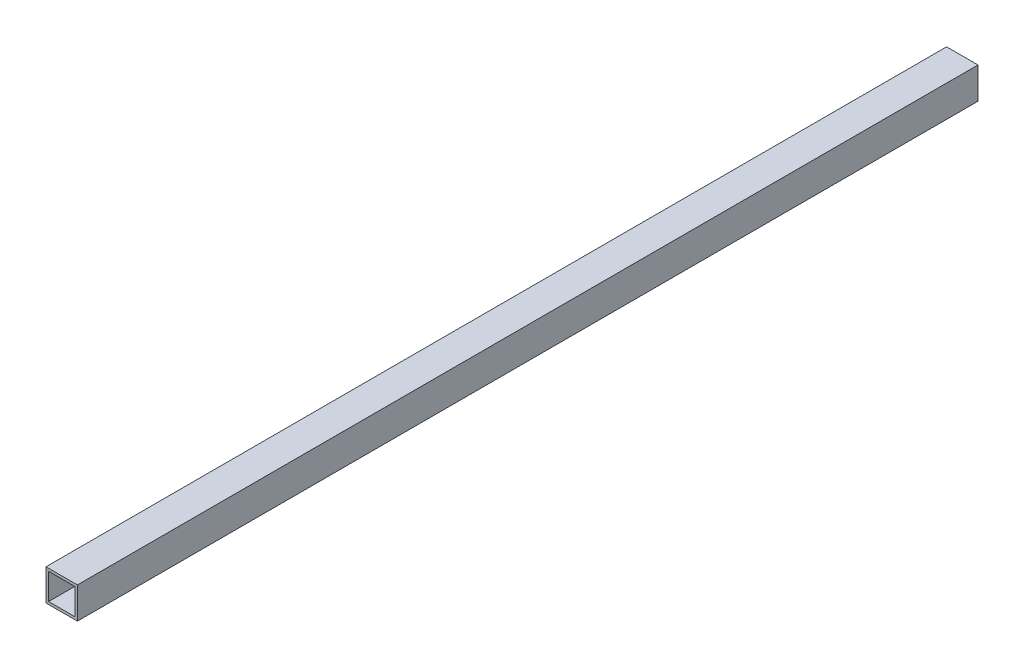
from build123d import *

# Parameters (mm, degrees)
SKETCH1_W           = 19.05
SKETCH1_H           = 19.05
SKETCH1_W_2         = 15.875
SKETCH1_H_2         = 15.875
BOSS_EXTRUDE1_DEPTH = 273.05


with BuildPart() as part:
    # Sketch1 → Boss-Extrude1 (new, symmetric)
    with BuildSketch(Plane.XY):
        Rectangle(SKETCH1_W, SKETCH1_H)
        Rectangle(SKETCH1_W_2, SKETCH1_H_2, mode=Mode.SUBTRACT)
    extrude(amount=BOSS_EXTRUDE1_DEPTH, both=True)


solid = part.part
